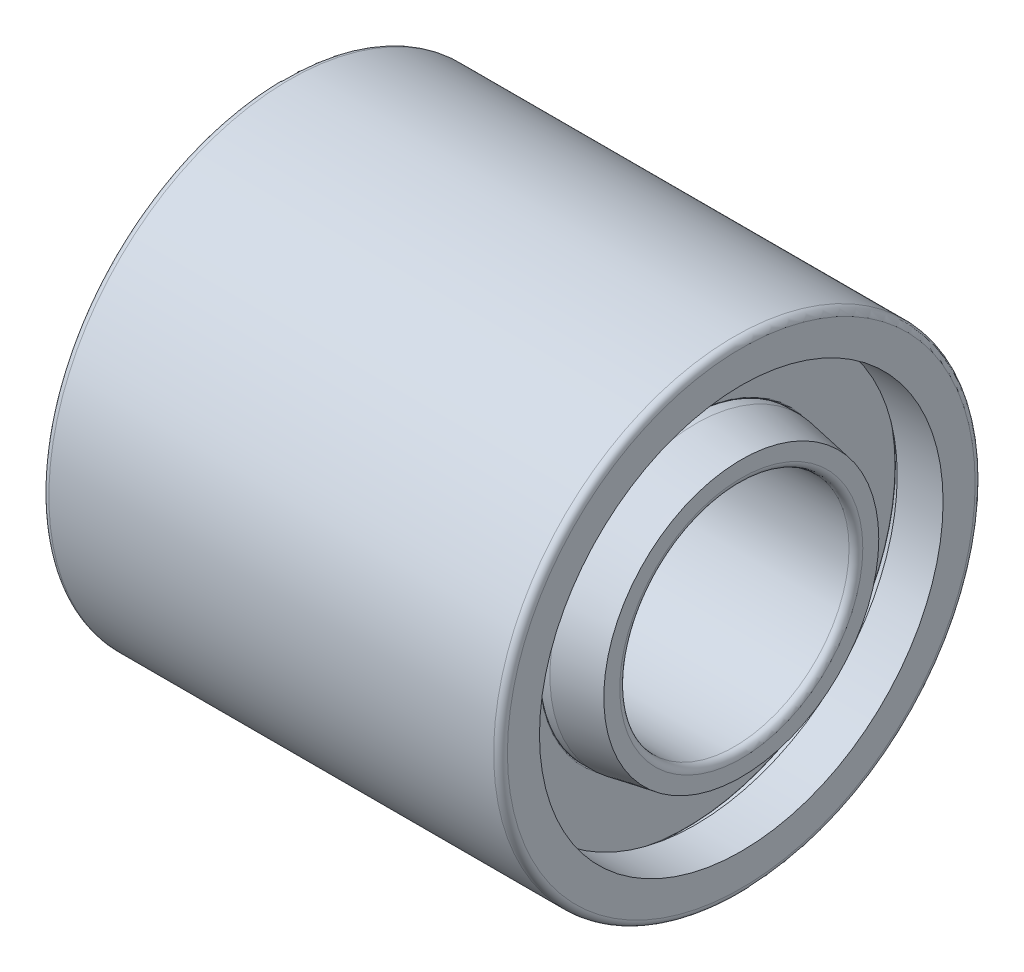
from build123d import *


with BuildPart() as part:
    # OutRacSke → OuterRace (revolve)
    with BuildSketch(Plane.XY):
        with BuildLine():
            Line((-16, 17.60375), (-20, 17.60375))
            Line((-20, 17.60375), (-20, 20.4))
            ThreePointArc((-20, 20.4), (-19.824264069, 20.824264069), (-19.4, 21))
            Line((-19.4, 21), (19.4, 21))
            ThreePointArc((19.4, 21), (19.824264069, 20.824264069), (20, 20.4))
            Line((20, 20.4), (20, 17.60375))
            Line((20, 17.60375), (16, 17.60375))
            Line((16, 17.60375), (16, 18.305))
            Line((16, 18.305), (-16, 18.305))
            Line((-16, 18.305), (-16, 17.60375))
        make_face()
    revolve(axis=Axis((-90, 0, 0), (1, 0, 0)))

    # RolSimSke → RollersSimplified (revolve)
    with BuildSketch(Plane(origin=(0, 101.6, 0), x_dir=(1, 0, 0), z_dir=(0, 0, 1))):
        with BuildLine():
            Line((-15.2, -83.4024), (-15.2, -88.7976))
            ThreePointArc((-15.2, -88.7976), (-15.167078802, -88.877078802), (-15.0876, -88.91))
            Line((-15.0876, -88.91), (15.0876, -88.91))
            ThreePointArc((15.0876, -88.91), (15.167078802, -88.877078802), (15.2, -88.7976))
            Line((15.2, -88.7976), (15.2, -83.4024))
            ThreePointArc((15.2, -83.4024), (15.167078802, -83.322921198), (15.0876, -83.29))
            Line((15.0876, -83.29), (-15.0876, -83.29))
            ThreePointArc((-15.0876, -83.29), (-15.167078802, -83.322921198), (-15.2, -83.4024))
        make_face()
    revolve(axis=Axis((25.4, 0, 0), (-1, 0, 0)))

    # InsRacSke → InnerRace (revolve)
    with BuildSketch(Plane.XY):
        with BuildLine():
            Line((-16, 12.695), (-20, 11.99375))
            Line((-20, 11.99375), (-20, 10.6))
            ThreePointArc((-20, 10.6), (-19.824264069, 10.175735931), (-19.4, 10))
            Line((-19.4, 10), (19.4, 10))
            ThreePointArc((19.4, 10), (19.824264069, 10.175735931), (20, 10.6))
            Line((20, 10.6), (20, 11.99375))
            Line((20, 11.99375), (16, 12.695))
            Line((16, 12.695), (-16, 12.695))
        make_face()
    revolve(axis=Axis((-90, 0, 0), (1, 0, 0)))


solid = part.part
